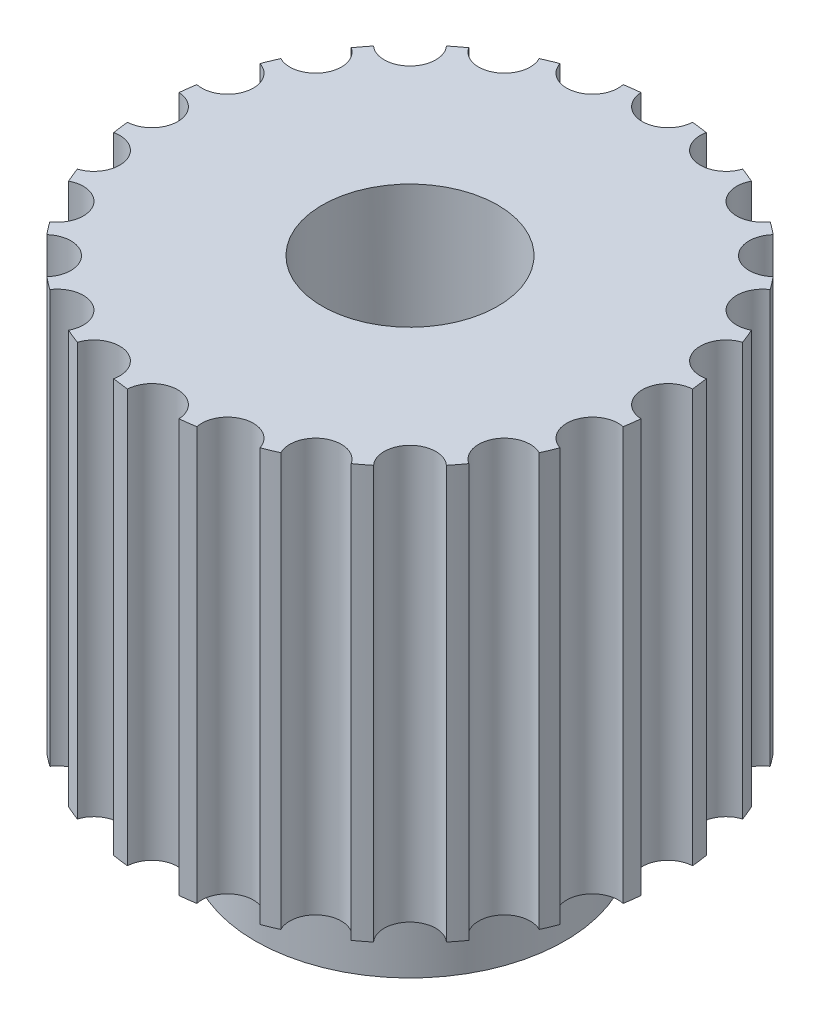
from build123d import *

# Parameters (mm, degrees)
CUT_EXTRUDE2_START        = -3
SKETCH3_R                 = 3
CUT_EXTRUDE2_DEPTH        = 2
M3X0_5_TAPPED_HOLE1_D     = 2.5
M3X0_5_TAPPED_HOLE1_DEPTH = 3
M3X0_5_TAPPED_HOLE1_TIP   = 0.751075774
SKETCH6_R                 = 0.5
CUT_EXTRUDE3_DEPTH        = 13.24744888
CIRPATTERN1_COUNT         = 24


with BuildPart() as part:
    # Sketch2 → Revolve2 (revolve)
    with BuildSketch(Plane.XY, mode=Mode.PRIVATE) as revolve2_sk:
        Polygon((-3, -5), (-1.7, -5), (-1.7, 5), (-5, 5), (-5, -3), (-3, -3), align=None)
        Polygon((1.7, -5), (3, -5), (3, -3), (5, -3), (5, 5), (1.7, 5), align=None)
    revolve(revolve2_sk.sketch.rotate(Axis((0, -5, 0), (0, 1, 0)), 270), axis=Axis((0, -5, 0), (0, 1, 0)))

    # Sketch3 → Cut-Extrude2 (cut)
    with BuildSketch(Plane(origin=(0, 0, 0), x_dir=(0, 0, -1), z_dir=(1, 0, 0)).offset(CUT_EXTRUDE2_START)):
        with Locations((0, 1)):
            Circle(SKETCH3_R)
    extrude(amount=-CUT_EXTRUDE2_DEPTH, mode=Mode.SUBTRACT)

    # M3x0.5 Tapped Hole1
    with Locations(Plane.ZY.offset(3)):
        with Locations((0, 1)):
            Hole(M3X0_5_TAPPED_HOLE1_D / 2, depth=M3X0_5_TAPPED_HOLE1_DEPTH)
            with Locations((0, 0, -(M3X0_5_TAPPED_HOLE1_DEPTH + M3X0_5_TAPPED_HOLE1_TIP / 2))):  # 118° drill point
                Cone(0, M3X0_5_TAPPED_HOLE1_D / 2, M3X0_5_TAPPED_HOLE1_TIP, mode=Mode.SUBTRACT)

    # Sketch6 → Cut-Extrude3 (cut, through all)
    with BuildSketch(Plane(origin=(0, 5, 0), x_dir=(1, 0, 0), z_dir=(0, 1, 0))):
        with Locations((0, 5)):
            Circle(SKETCH6_R)
    cut_extrude3 = extrude(amount=-CUT_EXTRUDE3_DEPTH, mode=Mode.SUBTRACT)

    # CirPattern1: Cut-Extrude3 ×24 about axis
    cirpattern1_axis = Axis((0, 0, 0), (0, 1, 0))
    for i in range(1, CIRPATTERN1_COUNT):
        add(cut_extrude3.rotate(cirpattern1_axis, i * 360 / CIRPATTERN1_COUNT), mode=Mode.SUBTRACT)


solid = part.part
